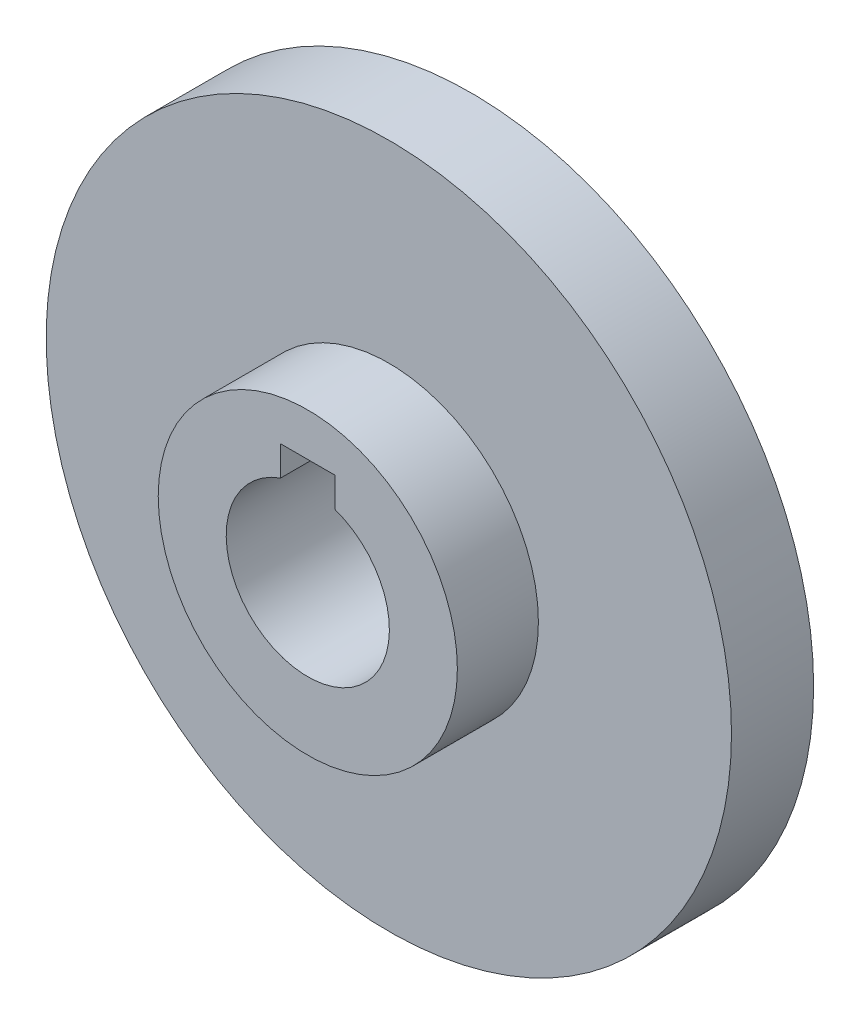
from build123d import *

# Parameters (mm, degrees)
SKETCH2_R           = 31.5
SKETCH2_R_2         = 7.5
BOSS_EXTRUDE1_DEPTH = 7.55
SKETCH4_R           = 13.75
SKETCH4_R_2         = 7.5
BOSS_EXTRUDE2_DEPTH = 7.45
CUT_EXTRUDE1_DEPTH  = 48.005318848


with BuildPart() as part:
    # Sketch2 → Boss-Extrude1 (new body)
    with BuildSketch(Plane.XY):
        Circle(SKETCH2_R)
        Circle(SKETCH2_R_2, mode=Mode.SUBTRACT)
    extrude(amount=BOSS_EXTRUDE1_DEPTH)

    # Sketch4 → Boss-Extrude2 (add)
    with BuildSketch(Plane.XY.offset(7.55)):
        Circle(SKETCH4_R)
        Circle(SKETCH4_R_2, mode=Mode.SUBTRACT)
    extrude(amount=BOSS_EXTRUDE2_DEPTH)

    # Sketch5 → Cut-Extrude1 (cut, through all)
    with BuildSketch(Plane.XY.offset(15)):
        with BuildLine():
            Line((2.5, 9.8), (-2.5, 9.8))
            Line((-2.5, 9.8), (-2.5, 7.071067812))
            ThreePointArc((-2.5, 7.071067812), (0, 7.5), (2.5, 7.071067812))
            Line((2.5, 7.071067812), (2.5, 9.8))
        make_face()
    extrude(amount=-CUT_EXTRUDE1_DEPTH, mode=Mode.SUBTRACT)


solid = part.part
